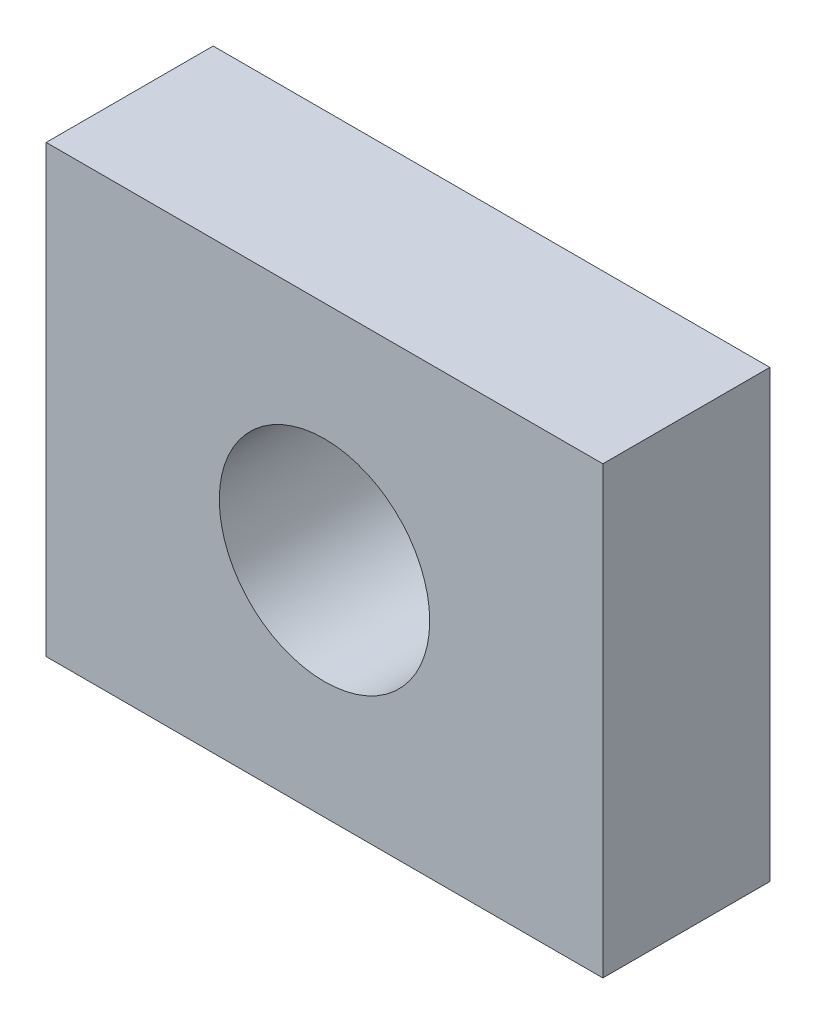
from build123d import *

# Parameters (mm, degrees)
SKETCH1_W           = 31.75
SKETCH1_H           = 25.4
SKETCH1_R           = 6
BOSS_EXTRUDE1_DEPTH = 9.525


with BuildPart() as part:
    # Sketch1 → Boss-Extrude1 (new body)
    with BuildSketch(Plane.XY):
        Rectangle(SKETCH1_W, SKETCH1_H)
        with Locations(Location((0, 0, 0), (0, 0, 180))):
            Circle(SKETCH1_R, mode=Mode.SUBTRACT)
    extrude(amount=BOSS_EXTRUDE1_DEPTH)


solid = part.part
